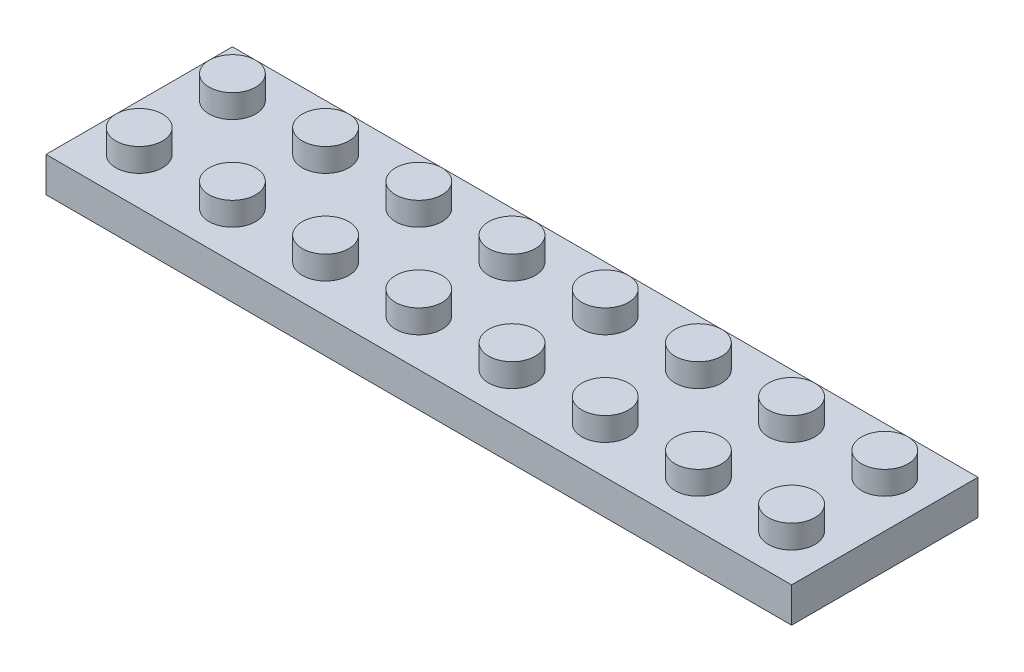
from build123d import *

# Parameters (mm, degrees)
SKETCH1_W           = 64
SKETCH1_H           = 16
BOSS_EXTRUDE1_DEPTH = 3
SKETCH2_R           = 2
BOSS_EXTRUDE2_DEPTH = 2
SHELL2_T            = -1
SKETCH3_R           = 2.8
SKETCH3_R_2         = 1.8
BOSS_EXTRUDE3_DEPTH = 2
LPATTERN1_COUNT     = 7
LPATTERN1_PITCH     = 8


with BuildPart() as part:
    # Sketch1 → Boss-Extrude1 (new body)
    with BuildSketch(Plane(origin=(0, 0, 0), x_dir=(1, 0, 0), z_dir=(0, 1, 0))):
        Rectangle(SKETCH1_W, SKETCH1_H)
    extrude(amount=BOSS_EXTRUDE1_DEPTH)

    # Sketch2 → Boss-Extrude2 (add)
    with BuildSketch(Plane(origin=(0, 3, 0), x_dir=(1, 0, 0), z_dir=(0, 1, 0))):
        with Locations(Location((-28, 4, 0), (0, 0, 270))):
            Circle(SKETCH2_R)
        with Locations(Location((-20, 4, 0), (0, 0, 270))):
            Circle(SKETCH2_R)
        with Locations(Location((-12, 4, 0), (0, 0, 270))):
            Circle(SKETCH2_R)
        with Locations(Location((-4, 4, 0), (0, 0, 270))):
            Circle(SKETCH2_R)
        with Locations(Location((4, 4, 0), (0, 0, 270))):
            Circle(SKETCH2_R)
        with Locations(Location((12, 4, 0), (0, 0, 270))):
            Circle(SKETCH2_R)
        with Locations(Location((20, 4, 0), (0, 0, 270))):
            Circle(SKETCH2_R)
        with Locations(Location((28, 4, 0), (0, 0, 270))):
            Circle(SKETCH2_R)
        with Locations(Location((-20, -4, 0), (0, 0, 270))):
            Circle(SKETCH2_R)
        with Locations(Location((-12, -4, 0), (0, 0, 270))):
            Circle(SKETCH2_R)
        with Locations(Location((-4, -4, 0), (0, 0, 270))):
            Circle(SKETCH2_R)
        with Locations(Location((4, -4, 0), (0, 0, 270))):
            Circle(SKETCH2_R)
        with Locations(Location((12, -4, 0), (0, 0, 270))):
            Circle(SKETCH2_R)
        with Locations(Location((20, -4, 0), (0, 0, 270))):
            Circle(SKETCH2_R)
        with Locations(Location((28, -4, 0), (0, 0, 270))):
            Circle(SKETCH2_R)
        with Locations(Location((-28, -4, 0), (0, 0, 270))):
            Circle(SKETCH2_R)
    extrude(amount=BOSS_EXTRUDE2_DEPTH)

    # Shell2
    shell2_openings = [part.faces().sort_by_distance(p)[0] for p in [
        (0, 0, 0),
    ]]
    offset(amount=SHELL2_T, openings=shell2_openings, kind=Kind.INTERSECTION)

    # Sketch3 → Boss-Extrude3 (add)
    with BuildSketch(Plane.XZ.offset(-2)):
        with Locations(Location((-23, 0, 0), (0, 0, 90))):
            Circle(SKETCH3_R)
        with Locations(Location((-23, 0, 0), (0, 0, 270))):
            Circle(SKETCH3_R_2, mode=Mode.SUBTRACT)
    boss_extrude3 = extrude(amount=BOSS_EXTRUDE3_DEPTH)

    # LPattern1: Boss-Extrude3 ×7
    with Locations(*[(i * LPATTERN1_PITCH, 0, 0) for i in range(1, LPATTERN1_COUNT)]):
        add(boss_extrude3)


solid = part.part
